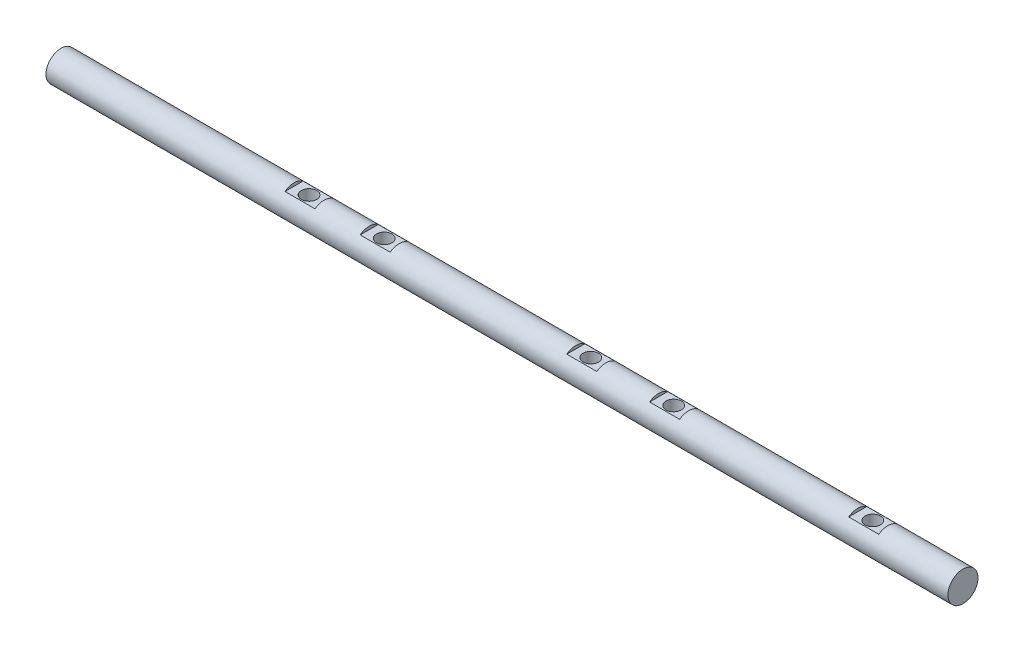
from build123d import *

# Parameters (mm, degrees)
SKETCH1_R               = 3.175
BOSS_EXTRUDE1_DEPTH     = 190.5
CUT_EXTRUDE1_DEPTH      = 191.552909319
CUT_EXTRUDE1_DEPTH_BACK = 191.552909319
SKETCH2_R               = 1.63195
CUT_EXTRUDE2_START      = 2.54
SKETCH2_3_W             = 6.35
SKETCH2_3_H             = 15.5259893
SKETCH2_3_R             = 1.63195
SKETCH2_3_H_2           = 21.77390706
CUT_EXTRUDE2_DEPTH      = 189.012909422


with BuildPart() as part:
    # Sketch1 → Boss-Extrude1 (new body)
    with BuildSketch(Plane(origin=(0, 0, 0), x_dir=(0, 0, -1), z_dir=(1, 0, 0))):
        Circle(SKETCH1_R)
    extrude(amount=BOSS_EXTRUDE1_DEPTH)

    # Sketch2 → Cut-Extrude1 (cut, two sides: drawn at the far end of the back side and taken through both)
    with BuildSketch(Plane(origin=(0, 0, 0), x_dir=(1, 0, 0), z_dir=(0, 1, 0)).offset(-CUT_EXTRUDE1_DEPTH_BACK)):
        with Locations((171.45, 0)):
            Circle(SKETCH2_R)
        with Locations((52.38623, 0)):
            Circle(SKETCH2_R)
        with Locations((111.9, 0)):
            Circle(SKETCH2_R)
        with Locations((68.26377, 0)):
            Circle(SKETCH2_R)
        with Locations((129.4, 0)):
            Circle(SKETCH2_R)
    extrude(amount=CUT_EXTRUDE1_DEPTH + CUT_EXTRUDE1_DEPTH_BACK, mode=Mode.SUBTRACT)

    # Sketch2<3> → Cut-Extrude2 (cut, through all)
    # profile 1 of 5: a face of its own
    with BuildSketch(Plane(origin=(0, 0, 0), x_dir=(1, 0, 0), z_dir=(0, 1, 0)).offset(CUT_EXTRUDE2_START)):
        with Locations((68.26377, 0)):
            Rectangle(SKETCH2_3_W, SKETCH2_3_H)
        with Locations((68.26377, 0)):
            Circle(SKETCH2_3_R, mode=Mode.SUBTRACT)
    # profile 2 of 5: a face of its own
    with BuildSketch(Plane(origin=(0, 0, 0), x_dir=(1, 0, 0), z_dir=(0, 1, 0)).offset(CUT_EXTRUDE2_START)):
        with Locations((52.38623, 0)):
            Rectangle(SKETCH2_3_W, SKETCH2_3_H)
        with Locations((52.38623, 0)):
            Circle(SKETCH2_3_R, mode=Mode.SUBTRACT)
    # profile 3 of 5: a face of its own
    with BuildSketch(Plane(origin=(0, 0, 0), x_dir=(1, 0, 0), z_dir=(0, 1, 0)).offset(CUT_EXTRUDE2_START)):
        with Locations((111.9, 0)):
            Rectangle(SKETCH2_3_W, SKETCH2_3_H)
    # profile 4 of 5: a face of its own
    with BuildSketch(Plane(origin=(0, 0, 0), x_dir=(1, 0, 0), z_dir=(0, 1, 0)).offset(CUT_EXTRUDE2_START)):
        with Locations((171.45, 0)):
            Rectangle(SKETCH2_3_W, SKETCH2_3_H_2)
        with Locations((171.45, 0)):
            Circle(SKETCH2_3_R, mode=Mode.SUBTRACT)
    # profile 5 of 5: a face of its own
    with BuildSketch(Plane(origin=(0, 0, 0), x_dir=(1, 0, 0), z_dir=(0, 1, 0)).offset(CUT_EXTRUDE2_START)):
        with Locations((129.4, 0)):
            Rectangle(SKETCH2_3_W, SKETCH2_3_H)
        with Locations((129.4, 0)):
            Circle(SKETCH2_3_R, mode=Mode.SUBTRACT)
    extrude(amount=CUT_EXTRUDE2_DEPTH, mode=Mode.SUBTRACT)


solid = part.part
